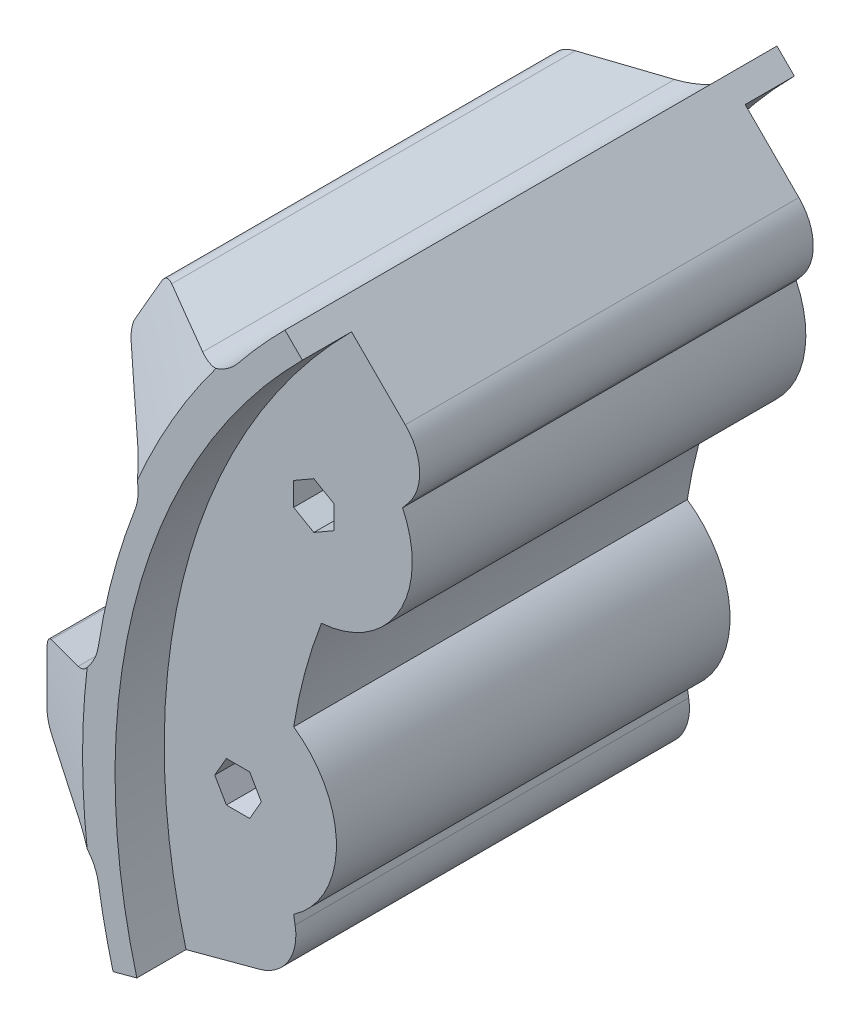
from build123d import *

# Parameters (mm, degrees)
SKETCH_1_R               = 130
SKETCH_1_R_2             = 105
EXTRUDE_1_DEPTH          = 80
CUT_EXTRUDE_1_DEPTH      = 201.499376558
EXTRUDE_2_DEPTH          = 10
EXTRUDE_2_DEPTH_BACK     = 90
SKETCH_5_R               = 150
SKETCH_5_R_2             = 130
EXTRUDE_3_DEPTH          = 80
EXTRUDE_4_DEPTH          = 100
CUT_EXTRUDE_4_DEPTH      = 240.414228959
FILLET_2_R               = 10
FILLET_3_R               = 3
CUT_EXTRUDE_5_DEPTH      = 236.41277176
CUT_EXTRUDE_5_DEPTH_BACK = 236.41277176
FILLET_4_R               = 10


with BuildPart() as part:
    # 草图1 → 凸台-拉伸1 (new body)
    with BuildSketch(Plane.XY):
        Circle(SKETCH_1_R)
        Circle(SKETCH_1_R_2, mode=Mode.SUBTRACT)
    extrude(amount=EXTRUDE_1_DEPTH)

    # 草图2 → 切除-拉伸1 (cut, through all)
    with BuildSketch(Plane.XY.offset(80)):
        Polygon((62.234272207, 99.592921435), (59.867136104, 103.692921435), (55.132863896, 103.692921435), (52.765727793, 99.592921435), (55.132863896, 95.492921435), (59.867136104, 95.492921435), align=None)
        Polygon((4.1, 117.367136104), (0, 119.734272207), (-4.1, 117.367136104), (-4.1, 112.632863896), (0, 110.265727793), (4.1, 112.632863896), align=None)
        Polygon((103.692921435, 55.132863896), (103.692921435, 59.867136104), (99.592921435, 62.234272207), (95.492921435, 59.867136104), (95.492921435, 55.132863896), (99.592921435, 52.765727793), align=None)
        Polygon((117.367136104, -4.1), (119.734272207, 0), (117.367136104, 4.1), (112.632863896, 4.1), (110.265727793, 0), (112.632863896, -4.1), align=None)
        Polygon((99.592921435, -62.234272207), (103.692921435, -59.867136104), (103.692921435, -55.132863896), (99.592921435, -52.765727793), (95.492921435, -55.132863896), (95.492921435, -59.867136104), align=None)
        Polygon((55.132863896, -103.692921435), (59.867136104, -103.692921435), (62.234272207, -99.592921435), (59.867136104, -95.492921435), (55.132863896, -95.492921435), (52.765727793, -99.592921435), align=None)
        Polygon((-4.1, -117.367136104), (0, -119.734272207), (4.1, -117.367136104), (4.1, -112.632863896), (0, -110.265727793), (-4.1, -112.632863896), align=None)
        Polygon((-62.234272207, -99.592921435), (-59.867136104, -103.692921435), (-55.132863896, -103.692921435), (-52.765727793, -99.592921435), (-55.132863896, -95.492921435), (-59.867136104, -95.492921435), align=None)
        Polygon((-103.692921435, -55.132863896), (-103.692921435, -59.867136104), (-99.592921435, -62.234272207), (-95.492921435, -59.867136104), (-95.492921435, -55.132863896), (-99.592921435, -52.765727793), align=None)
        Polygon((-117.367136104, 4.1), (-119.734272207, 0), (-117.367136104, -4.1), (-112.632863896, -4.1), (-110.265727793, 0), (-112.632863896, 4.1), align=None)
        Polygon((-99.592921435, 62.234272207), (-103.692921435, 59.867136104), (-103.692921435, 55.132863896), (-99.592921435, 52.765727793), (-95.492921435, 55.132863896), (-95.492921435, 59.867136104), align=None)
        Polygon((-55.132863896, 103.692921435), (-59.867136104, 103.692921435), (-62.234272207, 99.592921435), (-59.867136104, 95.492921435), (-55.132863896, 95.492921435), (-52.765727793, 99.592921435), align=None)
    extrude(amount=-CUT_EXTRUDE_1_DEPTH, mode=Mode.SUBTRACT)

    # 草图5 → 凸台-拉伸2 (add, two sides: drawn at the far end of the back side and taken through both)
    with BuildSketch(Plane.XY.offset(80).offset(-EXTRUDE_2_DEPTH_BACK)):
        Circle(SKETCH_5_R)
        Circle(SKETCH_5_R_2, mode=Mode.SUBTRACT)
    extrude(amount=EXTRUDE_2_DEPTH + EXTRUDE_2_DEPTH_BACK)

    # 草图7 → 凸台-拉伸3 (add)
    with BuildSketch(Plane.XY.offset(80)):
        with BuildLine():
            Line((-20, 115), (-7.5, 115))
            ThreePointArc((-7.5, 115), (0, 107.5), (7.5, 115))
            Line((7.5, 115), (20, 115))
            ThreePointArc((20, 115), (0, 95), (-20, 115))
        make_face()
        with BuildLine():
            Line((40.179491924, 109.592921435), (51.004809472, 103.342921435))
            ThreePointArc((51.004809472, 103.342921435), (53.75, 93.097730907), (63.995190528, 95.842921435))
            Line((63.995190528, 95.842921435), (74.820508076, 89.592921435))
            ThreePointArc((74.820508076, 89.592921435), (47.5, 82.27241336), (40.179491924, 109.592921435))
        make_face()
        with BuildLine():
            Line((89.592921435, 74.820508076), (95.842921435, 63.995190528))
            ThreePointArc((95.842921435, 63.995190528), (93.097730907, 53.75), (103.342921435, 51.004809472))
            Line((103.342921435, 51.004809472), (109.592921435, 40.179491924))
            ThreePointArc((109.592921435, 40.179491924), (82.27241336, 47.5), (89.592921435, 74.820508076))
        make_face()
        with BuildLine():
            Line((115, 20), (115, 7.5))
            ThreePointArc((115, 7.5), (107.5, 0), (115, -7.5))
            Line((115, -7.5), (115, -20))
            ThreePointArc((115, -20), (95, 0), (115, 20))
        make_face()
        with BuildLine():
            Line((109.592921435, -40.179491924), (103.342921435, -51.004809472))
            ThreePointArc((103.342921435, -51.004809472), (93.097730907, -53.75), (95.842921435, -63.995190528))
            Line((95.842921435, -63.995190528), (89.592921435, -74.820508076))
            ThreePointArc((89.592921435, -74.820508076), (82.27241336, -47.5), (109.592921435, -40.179491924))
        make_face()
        with BuildLine():
            Line((74.820508076, -89.592921435), (63.995190528, -95.842921435))
            ThreePointArc((63.995190528, -95.842921435), (53.75, -93.097730907), (51.004809472, -103.342921435))
            Line((51.004809472, -103.342921435), (40.179491924, -109.592921435))
            ThreePointArc((40.179491924, -109.592921435), (47.5, -82.27241336), (74.820508076, -89.592921435))
        make_face()
        with BuildLine():
            Line((20, -115), (7.5, -115))
            ThreePointArc((7.5, -115), (0, -107.5), (-7.5, -115))
            Line((-7.5, -115), (-20, -115))
            ThreePointArc((-20, -115), (0, -95), (20, -115))
        make_face()
        with BuildLine():
            Line((-40.179491924, -109.592921435), (-51.004809472, -103.342921435))
            ThreePointArc((-51.004809472, -103.342921435), (-53.75, -93.097730907), (-63.995190528, -95.842921435))
            Line((-63.995190528, -95.842921435), (-74.820508076, -89.592921435))
            ThreePointArc((-74.820508076, -89.592921435), (-47.5, -82.27241336), (-40.179491924, -109.592921435))
        make_face()
        with BuildLine():
            Line((-89.592921435, -74.820508076), (-95.842921435, -63.995190528))
            ThreePointArc((-95.842921435, -63.995190528), (-93.097730907, -53.75), (-103.342921435, -51.004809472))
            Line((-103.342921435, -51.004809472), (-109.592921435, -40.179491924))
            ThreePointArc((-109.592921435, -40.179491924), (-82.27241336, -47.5), (-89.592921435, -74.820508076))
        make_face()
        with BuildLine():
            Line((-115, -20), (-115, -7.5))
            ThreePointArc((-115, -7.5), (-107.5, 0), (-115, 7.5))
            Line((-115, 7.5), (-115, 20))
            ThreePointArc((-115, 20), (-95, 0), (-115, -20))
        make_face()
        with BuildLine():
            Line((-109.592921435, 40.179491924), (-103.342921435, 51.004809472))
            ThreePointArc((-103.342921435, 51.004809472), (-93.097730907, 53.75), (-95.842921435, 63.995190528))
            Line((-95.842921435, 63.995190528), (-89.592921435, 74.820508076))
            ThreePointArc((-89.592921435, 74.820508076), (-82.27241336, 47.5), (-109.592921435, 40.179491924))
        make_face()
        with BuildLine():
            Line((-74.820508076, 89.592921435), (-63.995190528, 95.842921435))
            ThreePointArc((-63.995190528, 95.842921435), (-53.75, 93.097730907), (-51.004809472, 103.342921435))
            Line((-51.004809472, 103.342921435), (-40.179491924, 109.592921435))
            ThreePointArc((-40.179491924, 109.592921435), (-47.5, 82.27241336), (-74.820508076, 89.592921435))
        make_face()
    extrude(amount=-EXTRUDE_3_DEPTH)

    # 草图8 → 凸台-拉伸4 (add, through all)
    with BuildSketch(Plane.XY.offset(90)):
        with BuildLine():
            Line((-7.5, 153.81673028), (-9.138136324, 149.721389469))
            ThreePointArc((-9.138136324, 149.721389469), (0, 150), (9.138136324, 149.721389469))
            Line((9.138136324, 149.721389469), (7.5, 153.81673028))
            Line((7.5, 153.81673028), (-7.5, 153.81673028))
        make_face()
        with BuildLine():
            ThreePointArc((-82.774552935, 125.093458608), (-75, 129.903810568), (-66.946836534, 134.231594932))
            Line((-66.946836534, 134.231594932), (-70.413174612, 136.959195949))
            Line((-70.413174612, 136.959195949), (-83.403555668, 129.459195949))
            Line((-83.403555668, 129.459195949), (-82.774552935, 125.093458608))
        make_face()
        with BuildLine():
            Line((70.413174612, 136.959195949), (66.946836534, 134.231594932))
            ThreePointArc((66.946836534, 134.231594932), (75, 129.903810568), (82.774552935, 125.093458608))
            Line((82.774552935, 125.093458608), (83.403555668, 129.459195949))
            Line((83.403555668, 129.459195949), (70.413174612, 136.959195949))
        make_face()
        with BuildLine():
            ThreePointArc((-134.231594932, 66.946836534), (-129.903810568, 75), (-125.093458608, 82.774552935))
            Line((-125.093458608, 82.774552935), (-129.459195949, 83.403555668))
            Line((-129.459195949, 83.403555668), (-136.959195949, 70.413174612))
            Line((-136.959195949, 70.413174612), (-134.231594932, 66.946836534))
        make_face()
        with BuildLine():
            Line((129.459195949, 83.403555668), (125.093458608, 82.774552935))
            ThreePointArc((125.093458608, 82.774552935), (129.903810568, 75), (134.231594932, 66.946836534))
            Line((134.231594932, 66.946836534), (136.959195949, 70.413174612))
            Line((136.959195949, 70.413174612), (129.459195949, 83.403555668))
        make_face()
        with BuildLine():
            ThreePointArc((-149.721389469, -9.138136324), (-150, 0), (-149.721389469, 9.138136324))
            Line((-149.721389469, 9.138136324), (-153.81673028, 7.5))
            Line((-153.81673028, 7.5), (-153.81673028, -7.5))
            Line((-153.81673028, -7.5), (-149.721389469, -9.138136324))
        make_face()
        with BuildLine():
            Line((153.81673028, 7.5), (149.721389469, 9.138136324))
            ThreePointArc((149.721389469, 9.138136324), (150, 0), (149.721389469, -9.138136324))
            Line((149.721389469, -9.138136324), (153.81673028, -7.5))
            Line((153.81673028, -7.5), (153.81673028, 7.5))
        make_face()
        with BuildLine():
            ThreePointArc((-125.093458608, -82.774552935), (-129.903810568, -75), (-134.231594932, -66.946836534))
            Line((-134.231594932, -66.946836534), (-136.959195949, -70.413174612))
            Line((-136.959195949, -70.413174612), (-129.459195949, -83.403555668))
            Line((-129.459195949, -83.403555668), (-125.093458608, -82.774552935))
        make_face()
        with BuildLine():
            ThreePointArc((-66.946836534, -134.231594932), (-75, -129.903810568), (-82.774552935, -125.093458608))
            Line((-82.774552935, -125.093458608), (-83.403555668, -129.459195949))
            Line((-83.403555668, -129.459195949), (-70.413174612, -136.959195949))
            Line((-70.413174612, -136.959195949), (-66.946836534, -134.231594932))
        make_face()
        with BuildLine():
            Line((136.959195949, -70.413174612), (134.231594932, -66.946836534))
            ThreePointArc((134.231594932, -66.946836534), (129.903810568, -75), (125.093458608, -82.774552935))
            Line((125.093458608, -82.774552935), (129.459195949, -83.403555668))
            Line((129.459195949, -83.403555668), (136.959195949, -70.413174612))
        make_face()
        with BuildLine():
            ThreePointArc((9.138136324, -149.721389469), (0, -150), (-9.138136324, -149.721389469))
            Line((-9.138136324, -149.721389469), (-7.5, -153.81673028))
            Line((-7.5, -153.81673028), (7.5, -153.81673028))
            Line((7.5, -153.81673028), (9.138136324, -149.721389469))
        make_face()
        with BuildLine():
            Line((83.403555668, -129.459195949), (82.774552935, -125.093458608))
            ThreePointArc((82.774552935, -125.093458608), (75, -129.903810568), (66.946836534, -134.231594932))
            Line((66.946836534, -134.231594932), (70.413174612, -136.959195949))
            Line((70.413174612, -136.959195949), (83.403555668, -129.459195949))
        make_face()
    extrude(amount=-EXTRUDE_4_DEPTH)

    # 草图10 → 切除-拉伸4 (cut, through all)
    with BuildSketch(Plane.XY.offset(90)):
        with BuildLine():
            Line((-9.138136324, 149.721389469), (-15.378189759, 134.121255883))
            ThreePointArc((-15.378189759, 134.121255883), (-34.940571089, 130.399986549), (-53.742724947, 123.841509662))
            Line((-53.742724947, 123.841509662), (-66.946836534, 134.231594932))
            ThreePointArc((-66.946836534, 134.231594932), (-38.822856765, 144.888873943), (-9.138136324, 149.721389469))
        make_face()
        with BuildLine():
            Line((9.138136324, 149.721389469), (15.378189759, 134.121255883))
            ThreePointArc((15.378189759, 134.121255883), (34.940571089, 130.399986549), (53.742724947, 123.841509662))
            Line((53.742724947, 123.841509662), (66.946836534, 134.231594932))
            ThreePointArc((66.946836534, 134.231594932), (38.822856765, 144.888873943), (9.138136324, 149.721389469))
        make_face()
        with BuildLine():
            Line((82.774552935, 125.093458608), (80.378530937, 108.463319903))
            ThreePointArc((80.378530937, 108.463319903), (95.45941546, 95.45941546), (108.463319903, 80.378530937))
            Line((108.463319903, 80.378530937), (125.093458608, 82.774552935))
            ThreePointArc((125.093458608, 82.774552935), (106.066017178, 106.066017178), (82.774552935, 125.093458608))
        make_face()
        with BuildLine():
            Line((134.231594932, 66.946836534), (123.841509662, 53.742724947))
            ThreePointArc((123.841509662, 53.742724947), (130.399986549, 34.940571089), (134.121255883, 15.378189759))
            Line((134.121255883, 15.378189759), (149.721389469, 9.138136324))
            ThreePointArc((149.721389469, 9.138136324), (144.888873943, 38.822856765), (134.231594932, 66.946836534))
        make_face()
        with BuildLine():
            Line((149.721389469, -9.138136324), (134.121255883, -15.378189759))
            ThreePointArc((134.121255883, -15.378189759), (130.399986549, -34.940571089), (123.841509662, -53.742724947))
            Line((123.841509662, -53.742724947), (134.231594932, -66.946836534))
            ThreePointArc((134.231594932, -66.946836534), (144.888873943, -38.822856765), (149.721389469, -9.138136324))
        make_face()
        with BuildLine():
            Line((125.093458608, -82.774552935), (108.463319903, -80.378530937))
            ThreePointArc((108.463319903, -80.378530937), (95.45941546, -95.45941546), (80.378530937, -108.463319903))
            Line((80.378530937, -108.463319903), (82.774552935, -125.093458608))
            ThreePointArc((82.774552935, -125.093458608), (106.066017178, -106.066017178), (125.093458608, -82.774552935))
        make_face()
        with BuildLine():
            Line((66.946836534, -134.231594932), (53.742724947, -123.841509662))
            ThreePointArc((53.742724947, -123.841509662), (34.940571089, -130.399986549), (15.378189759, -134.121255883))
            Line((15.378189759, -134.121255883), (9.138136324, -149.721389469))
            ThreePointArc((9.138136324, -149.721389469), (38.822856765, -144.888873943), (66.946836534, -134.231594932))
        make_face()
        with BuildLine():
            Line((-9.138136324, -149.721389469), (-15.378189759, -134.121255883))
            ThreePointArc((-15.378189759, -134.121255883), (-34.940571089, -130.399986549), (-53.742724947, -123.841509662))
            Line((-53.742724947, -123.841509662), (-66.946836534, -134.231594932))
            ThreePointArc((-66.946836534, -134.231594932), (-38.822856765, -144.888873943), (-9.138136324, -149.721389469))
        make_face()
        with BuildLine():
            Line((-82.774552935, -125.093458608), (-80.378530937, -108.463319903))
            ThreePointArc((-80.378530937, -108.463319903), (-95.45941546, -95.45941546), (-108.463319903, -80.378530937))
            Line((-108.463319903, -80.378530937), (-125.093458608, -82.774552935))
            ThreePointArc((-125.093458608, -82.774552935), (-106.066017178, -106.066017178), (-82.774552935, -125.093458608))
        make_face()
        with BuildLine():
            Line((-134.231594932, -66.946836534), (-123.841509662, -53.742724947))
            ThreePointArc((-123.841509662, -53.742724947), (-130.399986549, -34.940571089), (-134.121255883, -15.378189759))
            Line((-134.121255883, -15.378189759), (-149.721389469, -9.138136324))
            ThreePointArc((-149.721389469, -9.138136324), (-144.888873943, -38.822856765), (-134.231594932, -66.946836534))
        make_face()
        with BuildLine():
            Line((-149.721389469, 9.138136324), (-134.121255883, 15.378189759))
            ThreePointArc((-134.121255883, 15.378189759), (-130.399986549, 34.940571089), (-123.841509662, 53.742724947))
            Line((-123.841509662, 53.742724947), (-134.231594932, 66.946836534))
            ThreePointArc((-134.231594932, 66.946836534), (-144.888873943, 38.822856765), (-149.721389469, 9.138136324))
        make_face()
        with BuildLine():
            Line((-125.093458608, 82.774552935), (-108.463319903, 80.378530937))
            ThreePointArc((-108.463319903, 80.378530937), (-95.45941546, 95.45941546), (-80.378530937, 108.463319903))
            Line((-80.378530937, 108.463319903), (-82.774552935, 125.093458608))
            ThreePointArc((-82.774552935, 125.093458608), (-106.066017178, 106.066017178), (-125.093458608, 82.774552935))
        make_face()
    extrude(amount=-CUT_EXTRUDE_4_DEPTH, mode=Mode.SUBTRACT)

    # 圆角2
    fillet_2_edges = [part.edges().sort_by_distance(p)[0] for p in [
        (-80.378530937, 108.463319903, 40),
        (-108.463319903, 80.378530937, 40),
        (53.742724947, 123.841509662, 40),
        (15.378189759, 134.121255883, 40),
        (-123.841509662, 53.742724947, 40),
        (-134.121255883, 15.378189759, 40),
        (108.463319903, 80.378530937, 40),
        (80.378530937, 108.463319903, 40),
        (-53.742724947, -123.841509662, 40),
        (-15.378189759, -134.121255883, 40),
        (-108.463319903, -80.378530937, 40),
        (-80.378530937, -108.463319903, 40),
        (-134.121255883, -15.378189759, 40),
        (-123.841509662, -53.742724947, 40),
        (-15.378189759, 134.121255883, 40),
        (-53.742724947, 123.841509662, 40),
        (15.378189759, -134.121255883, 40),
        (53.742724947, -123.841509662, 40),
        (80.378530937, -108.463319903, 40),
        (108.463319903, -80.378530937, 40),
        (123.841509662, -53.742724947, 40),
        (134.121255883, -15.378189759, 40),
        (134.121255883, 15.378189759, 40),
        (123.841509662, 53.742724947, 40),
    ]]
    fillet(fillet_2_edges, radius=FILLET_2_R)

    # 圆角3
    fillet_3_edges = [part.edges().sort_by_distance(p)[0] for p in [
        (-153.81673028, -7.5, 40),
        (-153.81673028, 7.5, 40),
        (-136.959195949, 70.413174612, 40),
        (-129.459195949, 83.403555668, 40),
        (-83.403555668, 129.459195949, 40),
        (-70.413174612, 136.959195949, 40),
        (-7.5, 153.81673028, 40),
        (7.5, 153.81673028, 40),
        (70.413174612, 136.959195949, 40),
        (83.403555668, 129.459195949, 40),
        (129.459195949, 83.403555668, 40),
        (136.959195949, 70.413174612, 40),
        (153.81673028, 7.5, 40),
        (153.81673028, -7.5, 40),
        (136.959195949, -70.413174612, 40),
        (129.459195949, -83.403555668, 40),
        (83.403555668, -129.459195949, 40),
        (70.413174612, -136.959195949, 40),
        (7.5, -153.81673028, 40),
        (-7.5, -153.81673028, 40),
        (-70.413174612, -136.959195949, 40),
        (-83.403555668, -129.459195949, 40),
        (-129.459195949, -83.403555668, 40),
        (-136.959195949, -70.413174612, 40),
    ]]
    fillet(fillet_3_edges, radius=FILLET_3_R)

    # 草图11 → 切除-旋转4 (revolve, cut)
    with BuildSketch(Plane(origin=(0, 0, 0), x_dir=(1, 0, 0), z_dir=(0, 1, 0))):
        Polygon((-50, 60), (-160, -3.508529611), (-160, 60), align=None)
        Polygon((-160, -140), (-160, -76.491470389), (-50, -140), align=None)
    revolve(axis=Axis((0, 0, 0), (0, 0, -1)), mode=Mode.SUBTRACT)

    # 草图12 → 切除-拉伸5 (cut, two sides: drawn at the far end of the back side and taken through both)
    with BuildSketch(Plane.XY.offset(80).offset(-CUT_EXTRUDE_5_DEPTH_BACK)):
        with BuildLine():
            Line((0, 0), (-141.421356237, 141.421356237))
            ThreePointArc((-141.421356237, 141.421356237), (193.185165258, -51.763809021), (-193.185165258, -51.763809021))
            Line((-193.185165258, -51.763809021), (0, 0))
        make_face()
    extrude(amount=CUT_EXTRUDE_5_DEPTH + CUT_EXTRUDE_5_DEPTH_BACK, mode=Mode.SUBTRACT)

    # 圆角4
    fillet_4_edges = [part.edges().sort_by_distance(p)[0] for p in [
        (-74.246212025, 74.246212025, 40),
        (-101.42221176, -27.175999736, 40),
    ]]
    fillet(fillet_4_edges, radius=FILLET_4_R)


solid = part.part
